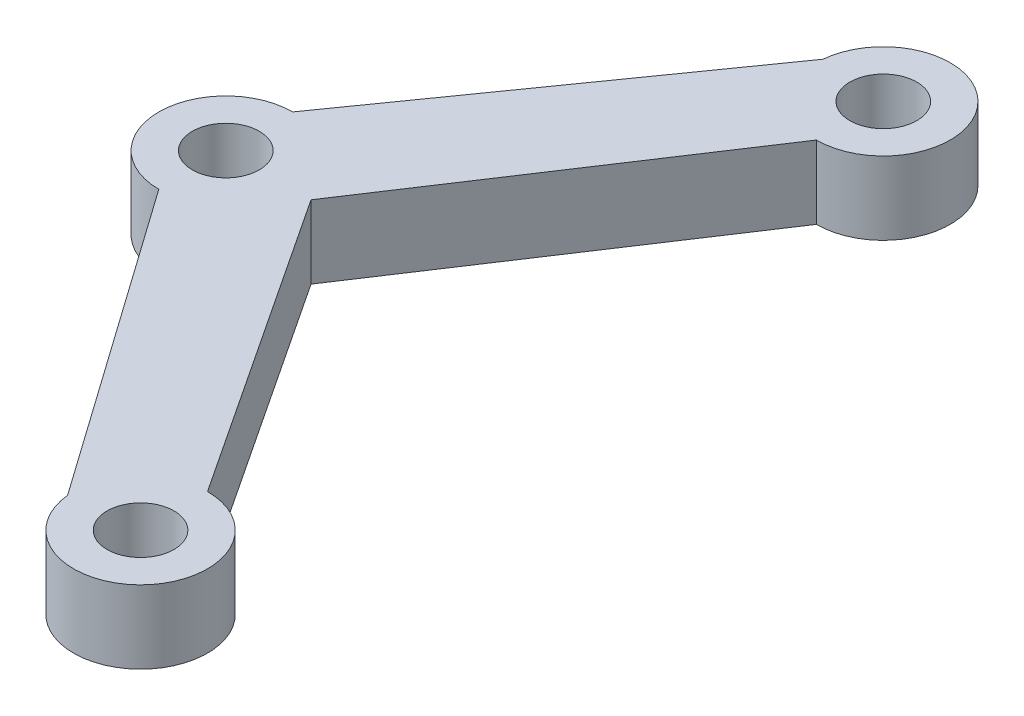
from build123d import *

# Parameters (mm, degrees)
SKETCH2_R           = 1.375
BOSS_EXTRUDE1_DEPTH = 3


with BuildPart() as part:
    # Sketch2 → Boss-Extrude1 (new body)
    with BuildSketch(Plane(origin=(0, 0, 0), x_dir=(1, 0, 0), z_dir=(0, 1, 0))):
        with BuildLine():
            Line((-27, -2.75), (-17.987773433, -15.509030166))
            ThreePointArc((-17.987773433, -15.509030166), (-13.21593597, -17.100698117), (-15.25, -12.5))
            Line((-15.25, -12.5), (-23.5, 0))
            Line((-23.5, 0), (-15.25, 12.5))
            ThreePointArc((-15.25, 12.5), (-13.21593597, 17.100698117), (-17.987773433, 15.509030166))
            Line((-17.987773433, 15.509030166), (-27, 2.75))
            ThreePointArc((-27, 2.75), (-29.75, 0), (-27, -2.75))
        make_face()
        with Locations(Location((-27, 0, 0), (0, 0, 270))):
            Circle(SKETCH2_R, mode=Mode.SUBTRACT)
        with Locations(Location((-15.25, 15.25, 0), (0, 0, 270))):
            Circle(SKETCH2_R, mode=Mode.SUBTRACT)
        with Locations(Location((-15.25, -15.25, 0), (0, 0, 270))):
            Circle(SKETCH2_R, mode=Mode.SUBTRACT)
    extrude(amount=BOSS_EXTRUDE1_DEPTH)


solid = part.part
